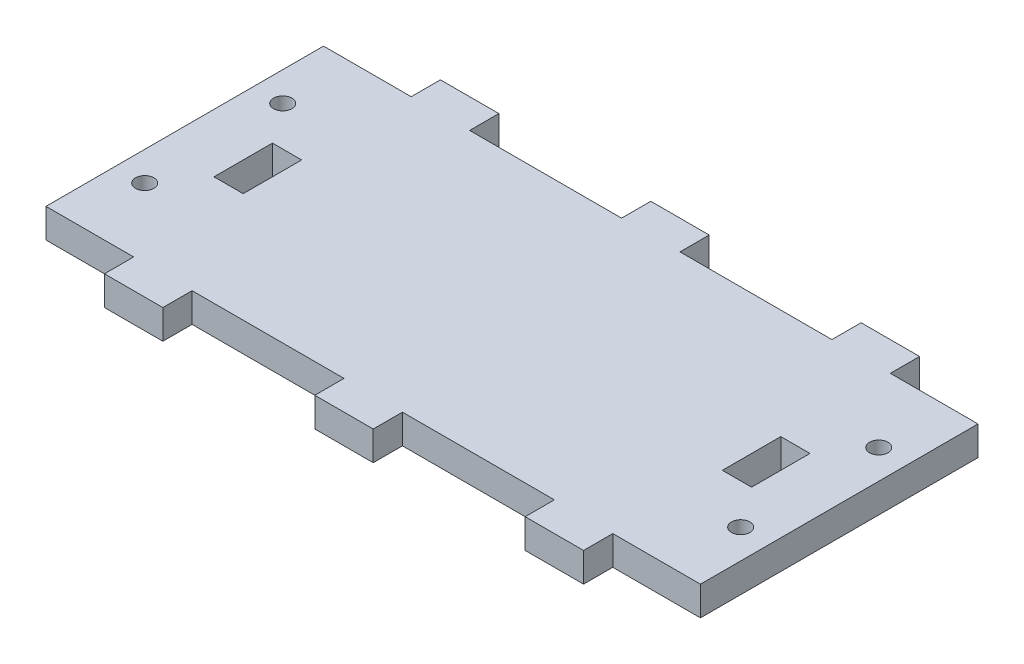
from build123d import *

# Parameters (mm, degrees)
SKETCH1_W           = 142.24
SKETCH1_H           = 60.325
BOSS_EXTRUDE1_DEPTH = 6.35
SKETCH2_R           = 2
SKETCH2_W           = 6.35
SKETCH2_H           = 12.7
CUT_EXTRUDE1_DEPTH  = 155.633908717
SKETCH3_W           = 12.7
SKETCH3_H           = 6.35
BOSS_EXTRUDE2_DEPTH = 6.35


with BuildPart() as part:
    # Sketch1 → Boss-Extrude1 (new body)
    with BuildSketch(Plane(origin=(0, 0, 0), x_dir=(1, 0, 0), z_dir=(0, 1, 0))):
        with Locations((71.12, -30.1625)):
            Rectangle(SKETCH1_W, SKETCH1_H)
    extrude(amount=BOSS_EXTRUDE1_DEPTH)

    # Sketch2 → Cut-Extrude1 (cut, through all)
    with BuildSketch(Plane(origin=(0, 6.35, 0), x_dir=(1, 0, 0), z_dir=(0, 1, 0))):
        with Locations(Location((6.35, -15.225, 0), (0, 0, 270))):
            Circle(SKETCH2_R)
        with Locations(Location((6.35, -45.225, 0), (0, 0, 270))):
            Circle(SKETCH2_R)
        with Locations(Location((135.89, -45.225, 0), (0, 0, 90))):
            Circle(SKETCH2_R)
        with Locations(Location((135.89, -15.225, 0), (0, 0, 90))):
            Circle(SKETCH2_R)
        with Locations((126.365, -30.1625)):
            Rectangle(SKETCH2_W, SKETCH2_H)
        with Locations((15.875, -30.1625)):
            Rectangle(SKETCH2_W, SKETCH2_H)
    extrude(amount=-CUT_EXTRUDE1_DEPTH, mode=Mode.SUBTRACT)

    # Sketch3 → Boss-Extrude2 (add)
    with BuildSketch(Plane(origin=(0, 6.35, 0), x_dir=(1, 0, 0), z_dir=(0, 1, 0))):
        with Locations((25.4, 3.175)):
            Rectangle(SKETCH3_W, SKETCH3_H)
        with Locations((116.84, 3.175)):
            Rectangle(SKETCH3_W, SKETCH3_H)
        with Locations((116.84, -63.5)):
            Rectangle(SKETCH3_W, SKETCH3_H)
        with Locations((25.4, -63.5)):
            Rectangle(SKETCH3_W, SKETCH3_H)
        with Locations((71.12, -63.5)):
            Rectangle(SKETCH3_W, SKETCH3_H)
        with Locations((71.12, 3.175)):
            Rectangle(SKETCH3_W, SKETCH3_H)
    extrude(amount=-BOSS_EXTRUDE2_DEPTH)


solid = part.part
